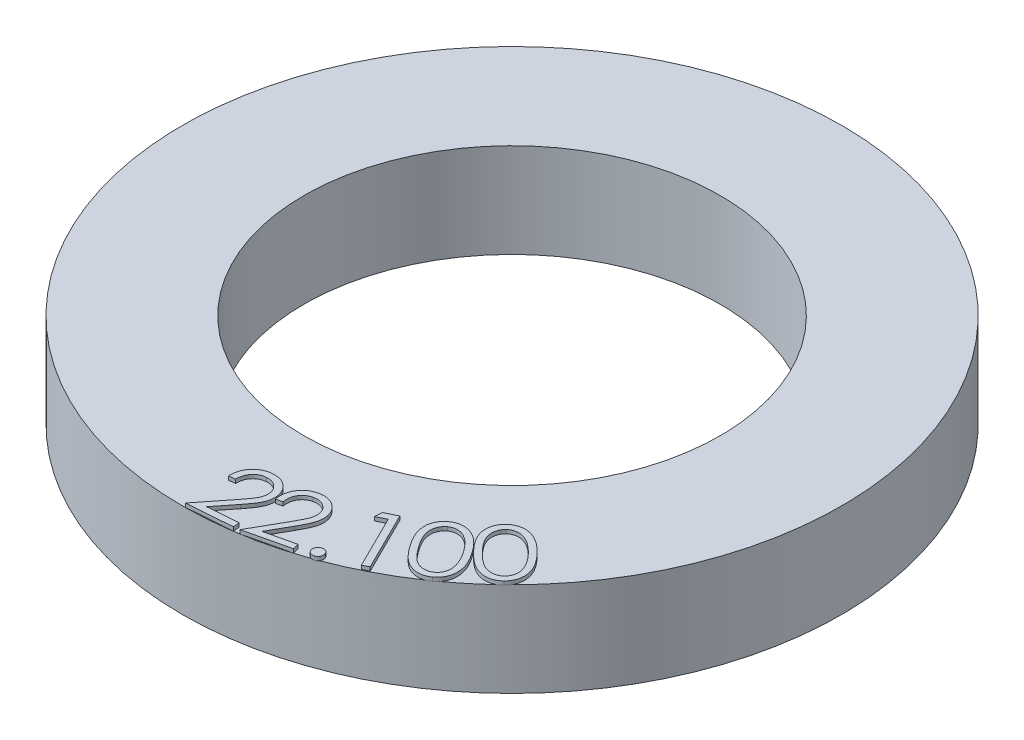
from build123d import *

# Parameters (mm, degrees)
SKETCH1_R           = 17.5
SKETCH1_R_2         = 11.05
BOSS_EXTRUDE1_DEPTH = 5
BOSS_EXTRUDE5_DEPTH = 0.2


with BuildPart() as part:
    # Sketch1 → Boss-Extrude1 (new body)
    with BuildSketch(Plane(origin=(0, 0, 0), x_dir=(1, 0, 0), z_dir=(0, 1, 0))):
        Circle(SKETCH1_R)
        Circle(SKETCH1_R_2, mode=Mode.SUBTRACT)
    extrude(amount=BOSS_EXTRUDE1_DEPTH)

    # Sketch5 → Boss-Extrude5 (add)
    # profile 1 of 6: a face of its own
    with BuildSketch(Plane(origin=(0, 5, 0), x_dir=(1, 0, 0), z_dir=(0, 1, 0))):
        with BuildLine():
            Line((0.377203526, -15.06640625), (0.043469551, -15.092347756))
            add(Edge.make_bspline(
                [(0.043469551, -15.092347756), (0.042203297, -15.050032699), (0.039723419, -14.96716131), (0.049638285, -14.844981972), (0.067688405, -14.727624407), (0.098455755, -14.61556583), (0.138504263, -14.508522308), (0.188279293, -14.405930448), (0.249943807, -14.309195828), (0.320224245, -14.217586795), (0.399116148, -14.133937543), (0.484222111, -14.059456033), (0.574336923, -13.993992114), (0.671078969, -13.940092371), (0.773224869, -13.895612995), (0.881084602, -13.861423192), (0.994390789, -13.836174987), (1.072362547, -13.828578994), (1.111979167, -13.824719551)],
                knots=[0, 0, 0, 0, 1.099165856, 2.152647473, 3.179901334, 4.180092559, 5.165857059, 6.14623908, 7.136854445, 8.141313093, 9.142222958, 10.119044223, 11.076246807, 12.030555843, 12.990566437, 13.966122304, 14.966608418, 16, 16, 16, 16], degree=3))
            add(Edge.make_bspline(
                [(1.111979167, -13.824719551), (1.151232363, -13.822614291), (1.227892409, -13.818502795), (1.341072803, -13.824300473), (1.449209712, -13.840047194), (1.552456645, -13.867170925), (1.650809554, -13.903432336), (1.744251767, -13.950064736), (1.832189716, -14.007297288), (1.914237577, -14.07371881), (1.989801801, -14.146775331), (2.056191283, -14.225750107), (2.115236363, -14.307662186), (2.163673815, -14.394967734), (2.203994369, -14.485852699), (2.23381166, -14.581483532), (2.256306856, -14.680631266), (2.263224051, -14.74868976), (2.266726763, -14.783153045)],
                knots=[0, 0, 0, 0, 1.125255338, 2.197582177, 3.23984224, 4.249678898, 5.249348258, 6.237204937, 7.234226399, 8.248247252, 9.256507582, 10.239567543, 11.199778339, 12.143800945, 13.093950023, 14.042329097, 15.008679649, 16, 16, 16, 16], degree=3))
            add(Edge.make_bspline(
                [(2.266726763, -14.783153045), (2.268653871, -14.83201524), (2.272472697, -14.928842275), (2.256591946, -15.073272294), (2.221554197, -15.213909987), (2.177756368, -15.329043673), (2.13210079, -15.422970742), (2.088829613, -15.499650514), (2.039151976, -15.583479859), (1.980752569, -15.67318269), (1.913642882, -15.76882397), (1.840613729, -15.872212721), (1.757921696, -15.980725817), (1.700055339, -16.055042687), (1.670072115, -16.093549679)],
                knots=[0, 0, 0, 0, 1.190284496, 2.358709392, 3.525773572, 4.713480732, 5.352743619, 6.06901355, 6.858115264, 7.726847504, 8.676217017, 9.704931629, 10.810819393, 12, 12, 12, 12], degree=3))
            Line((1.670072115, -16.093549679), (0.875701122, -17.094751603))
            Line((0.875701122, -17.094751603), (2.482672276, -16.971354167))
            Line((2.482672276, -16.971354167), (2.508613782, -17.307191506))
            Line((2.508613782, -17.307191506), (0.14443109, -17.488782051))
            Line((0.14443109, -17.488782051), (1.363681891, -15.949819712))
            add(Edge.make_bspline(
                [(1.363681891, -15.949819712), (1.393527022, -15.912554926), (1.450782044, -15.841066007), (1.530584566, -15.73612355), (1.602999147, -15.639675593), (1.666852925, -15.550639363), (1.722438282, -15.469396851), (1.76961629, -15.395481899), (1.809021619, -15.329602995), (1.849329165, -15.251857602), (1.888211722, -15.159145837), (1.917541309, -15.046099013), (1.933704742, -14.93175562), (1.93042781, -14.855174346), (1.928786058, -14.816806891)],
                knots=[0, 0, 0, 0, 1.323859622, 2.539697786, 3.655679983, 4.668207506, 5.577749991, 6.384956845, 7.099630202, 7.705429782, 8.812646299, 9.878423536, 10.93708365, 12, 12, 12, 12], degree=3))
            add(Edge.make_bspline(
                [(1.928786058, -14.816806891), (1.92620974, -14.792668697), (1.921140936, -14.745177743), (1.905685163, -14.675960851), (1.882668381, -14.610204079), (1.854314913, -14.54686504), (1.818130268, -14.487171166), (1.775716227, -14.430480301), (1.726271651, -14.377301953), (1.671340099, -14.327125852), (1.611934069, -14.281949704), (1.548780398, -14.24375581), (1.483443961, -14.212316408), (1.415907726, -14.186368957), (1.345139571, -14.169292508), (1.271999298, -14.157876025), (1.196114655, -14.153502913), (1.144924611, -14.156323447), (1.118990385, -14.157752404)],
                knots=[0, 0, 0, 0, 1.002985613, 1.973335034, 2.923515741, 3.878986154, 4.836651989, 5.802759845, 6.800988188, 7.833639541, 8.87511098, 9.880838076, 10.878972912, 11.86950441, 12.865345595, 13.881918786, 14.926924211, 16, 16, 16, 16], degree=3))
            add(Edge.make_bspline(
                [(1.118990385, -14.157752404), (1.091811261, -14.160540619), (1.038491161, -14.166010548), (0.960749235, -14.182373159), (0.886899306, -14.205342141), (0.817246391, -14.235736869), (0.751710741, -14.272344942), (0.690146343, -14.315288584), (0.633132276, -14.365692478), (0.580060436, -14.422065975), (0.532383632, -14.484564259), (0.490634628, -14.552362028), (0.455698611, -14.625546395), (0.426899376, -14.703718722), (0.404472482, -14.787020099), (0.388336351, -14.875402791), (0.379467781, -14.969236984), (0.377971809, -15.033435801), (0.377203526, -15.06640625)],
                knots=[0, 0, 0, 0, 1.003856858, 1.969369873, 2.914991585, 3.842326504, 4.757764574, 5.67065914, 6.596081697, 7.550367434, 8.512664105, 9.480773, 10.472199548, 11.488843046, 12.539268398, 13.639696742, 14.787824085, 16, 16, 16, 16], degree=3))
        make_face()
    # profile 2 of 6: a face of its own
    with BuildSketch(Plane(origin=(0, 5, 0), x_dir=(1, 0, 0), z_dir=(0, 1, 0))):
        with BuildLine():
            Line((2.680077799, -14.84254585), (2.355458408, -14.918267004))
            add(Edge.make_bspline(
                [(2.355458408, -14.918267004), (2.347994142, -14.876767046), (2.333387531, -14.795556953), (2.323472579, -14.673990721), (2.324976016, -14.555728299), (2.336513827, -14.440605451), (2.359783356, -14.328975701), (2.394590343, -14.221092867), (2.439601661, -14.116379831), (2.494569659, -14.015576781), (2.559832485, -13.921863348), (2.631188548, -13.834656401), (2.710921768, -13.757361702), (2.797573287, -13.688946733), (2.891342116, -13.629703088), (2.992353062, -13.580084855), (3.099856127, -13.537971321), (3.175300136, -13.518303724), (3.213631485, -13.508311075)],
                knots=[0, 0, 0, 0, 1.100238416, 2.153025381, 3.178012026, 4.183884262, 5.168591255, 6.148695239, 7.138002634, 8.140019377, 9.140121407, 10.114951831, 11.077023251, 12.032670763, 12.99234068, 13.966349905, 14.966749606, 16, 16, 16, 16], degree=3))
            add(Edge.make_bspline(
                [(3.213631485, -13.508311075), (3.251843088, -13.50036415), (3.32664053, -13.484808413), (3.438897548, -13.473770246), (3.547813259, -13.472847982), (3.653615731, -13.482442125), (3.755983303, -13.503477882), (3.854414489, -13.536291351), (3.950096274, -13.578421826), (4.040814221, -13.631584861), (4.126003653, -13.692404589), (4.204208412, -13.758970295), (4.274030899, -13.831494589), (4.335160407, -13.90960072), (4.388361962, -13.993145467), (4.432982751, -14.082231672), (4.470178835, -14.176708828), (4.487307474, -14.242643219), (4.495983248, -14.27603944)],
                knots=[0, 0, 0, 0, 1.121990491, 2.196244399, 3.238232453, 4.250969426, 5.246356061, 6.236987075, 7.230101134, 8.248200839, 9.255501669, 10.237657177, 11.19803806, 12.146105858, 13.086011545, 14.042029985, 15.008274769, 16, 16, 16, 16], degree=3))
            add(Edge.make_bspline(
                [(4.495983248, -14.27603944), (4.505415824, -14.323774993), (4.524110077, -14.41838123), (4.529985585, -14.56283772), (4.516844757, -14.706380405), (4.49162199, -14.826395359), (4.460506924, -14.925374116), (4.431085731, -15.007919873), (4.393488718, -15.097141834), (4.349829317, -15.194418504), (4.299347185, -15.299042154), (4.242538162, -15.411720311), (4.177915647, -15.531101044), (4.131979942, -15.612908193), (4.108262895, -15.655146011)],
                knots=[0, 0, 0, 0, 1.190223456, 2.358882579, 3.52524119, 4.712819824, 5.35365978, 6.065105631, 6.857984567, 7.723828008, 8.67607557, 9.702436758, 10.813745988, 12, 12, 12, 12], degree=3))
            Line((4.108262895, -15.655146011), (3.479356645, -16.761516203))
            Line((3.479356645, -16.761516203), (5.041456004, -16.394829504))
            Line((5.041456004, -16.394829504), (5.11787828, -16.721552261))
            Line((5.11787828, -16.721552261), (2.819601036, -17.260714921))
            Line((2.819601036, -17.260714921), (3.785045748, -15.56119569))
            add(Edge.make_bspline(
                [(3.785045748, -15.56119569), (3.808529371, -15.519892567), (3.8536226, -15.440582352), (3.91665988, -15.325551236), (3.973290102, -15.219474376), (4.021957514, -15.121779814), (4.064311127, -15.032979861), (4.100364837, -14.953571722), (4.128654637, -14.882434307), (4.156784414, -14.800101176), (4.179688984, -14.702577351), (4.192972915, -14.587024863), (4.189968714, -14.471889792), (4.175230987, -14.396958355), (4.167858248, -14.359472934)],
                knots=[0, 0, 0, 0, 1.322508168, 2.539478858, 3.65113322, 4.669382137, 5.577246142, 6.389686428, 7.096378664, 7.707362647, 8.810322298, 9.877140803, 10.938012216, 12, 12, 12, 12], degree=3))
            add(Edge.make_bspline(
                [(4.167858248, -14.359472934), (4.161829404, -14.336171476), (4.149935411, -14.290201239), (4.123387221, -14.224893717), (4.091995869, -14.16328915), (4.053584185, -14.106135055), (4.009399893, -14.052600205), (3.95860095, -14.003544562), (3.901957352, -13.958350343), (3.840235373, -13.917568468), (3.775029978, -13.881814057), (3.707248163, -13.853637752), (3.637912338, -13.832678602), (3.56741324, -13.817301491), (3.494890393, -13.811664684), (3.421495235, -13.811468351), (3.346244991, -13.818247864), (3.296509601, -13.82889709), (3.271123472, -13.834332709)],
                knots=[0, 0, 0, 0, 0.998805992, 1.97049261, 2.921394182, 3.866479787, 4.824835265, 5.799717433, 6.794315519, 7.830951375, 8.869177059, 9.878822869, 10.873799922, 11.875291578, 12.869368348, 13.888722291, 14.922353531, 16, 16, 16, 16], degree=3))
            add(Edge.make_bspline(
                [(3.271123472, -13.834332709), (3.244792519, -13.841064204), (3.193002937, -13.854304184), (3.119061623, -13.882705923), (3.050115946, -13.91714881), (2.986034959, -13.957311139), (2.926579811, -14.002814596), (2.87305675, -14.05555418), (2.823928987, -14.113545846), (2.780414933, -14.177443519), (2.743380272, -14.246402199), (2.712244756, -14.319205359), (2.689061885, -14.396615139), (2.673136557, -14.477873433), (2.664009273, -14.563501926), (2.662180891, -14.653056839), (2.666949138, -14.746824786), (2.675629023, -14.810109822), (2.680077799, -14.84254585)],
                knots=[0, 0, 0, 0, 1.001857296, 1.97052376, 2.915105733, 3.840812044, 4.756468097, 5.670946457, 6.606992161, 7.556283339, 8.516782409, 9.490308786, 10.47212129, 11.491627338, 12.540773751, 13.644567144, 14.792749573, 16, 16, 16, 16], degree=3))
        make_face()
    # profile 3 of 6: a face of its own
    with BuildSketch(Plane(origin=(0, 5, 0), x_dir=(1, 0, 0), z_dir=(0, 1, 0))):
        with BuildLine():
            add(Edge.make_bspline(
                [(5.812610444, -15.938128556), (5.831374417, -15.932374898), (5.868100028, -15.921113607), (5.925587729, -15.918820778), (5.982023209, -15.927326543), (6.036365652, -15.947186897), (6.086750753, -15.976062519), (6.129683552, -16.014781695), (6.164195697, -16.061839206), (6.179302393, -16.097844445), (6.187009483, -16.116213491)],
                knots=[0, 0, 0, 0, 1.018533362, 1.993514881, 2.966138152, 3.9748784, 4.989476654, 5.972026843, 6.965374611, 8, 8, 8, 8], degree=3))
            add(Edge.make_bspline(
                [(6.187009483, -16.116213491), (6.192680674, -16.134982532), (6.203852009, -16.171954526), (6.207259114, -16.229869607), (6.198423544, -16.286997519), (6.178873974, -16.341926891), (6.149719297, -16.392227049), (6.111823907, -16.435344643), (6.065578658, -16.469979456), (6.029886494, -16.484584723), (6.011729034, -16.492014773)],
                knots=[0, 0, 0, 0, 1.018247088, 2.005783202, 2.990165439, 4.010083513, 5.024396598, 5.998572224, 6.981825626, 8, 8, 8, 8], degree=3))
            add(Edge.make_bspline(
                [(6.011729034, -16.492014773), (5.992964701, -16.497770106), (5.956238387, -16.509034678), (5.898755786, -16.511303732), (5.842003107, -16.502843983), (5.787364663, -16.482393394), (5.737095106, -16.452595757), (5.694096527, -16.414271405), (5.660232144, -16.367416245), (5.645083379, -16.332037335), (5.637329996, -16.313929838)],
                knots=[0, 0, 0, 0, 1.019327242, 1.995068695, 2.968450063, 3.99358383, 5.015165017, 5.99848104, 6.975590248, 8, 8, 8, 8], degree=3))
            add(Edge.make_bspline(
                [(5.637329996, -16.313929838), (5.63125142, -16.294941947), (5.619366426, -16.257816312), (5.617673921, -16.1996281), (5.624612676, -16.142442807), (5.645777227, -16.087974496), (5.675371175, -16.038150206), (5.712952105, -15.994657098), (5.759716127, -15.961248414), (5.794765915, -15.945928316), (5.812610444, -15.938128556)],
                knots=[0, 0, 0, 0, 1.033330105, 2.02039479, 3.003248301, 4.016090021, 5.036799157, 6.01117572, 6.98745084, 8, 8, 8, 8], degree=3))
        make_face()
    # profile 4 of 6: a face of its own
    with BuildSketch(Plane(origin=(0, 5, 0), x_dir=(1, 0, 0), z_dir=(0, 1, 0))):
        Polygon((5.818273577, -12.696277718), (6.43245627, -12.391289737), (7.984038802, -15.51759182), (7.673441847, -15.671838615), (6.274002744, -12.851926756), (5.783217488, -13.095216019), align=None)
    # profile 5 of 6: a face of its own
    with BuildSketch(Plane(origin=(0, 5, 0), x_dir=(1, 0, 0), z_dir=(0, 1, 0))):
        with BuildLine():
            add(Edge.make_bspline(
                [(8.094622628, -13.519240223), (8.062802559, -13.473618044), (8.000905639, -13.384873031), (7.915172489, -13.252508419), (7.839826708, -13.124911808), (7.772418464, -13.003590397), (7.715531182, -12.886947474), (7.667790368, -12.775573225), (7.628608309, -12.669765668), (7.599775725, -12.568374636), (7.57829551, -12.470964938), (7.564758618, -12.376238395), (7.555557095, -12.284294604), (7.554709495, -12.194779161), (7.558280296, -12.107556209), (7.56976583, -12.022720596), (7.587145911, -11.940382527), (7.611262051, -11.861045683), (7.640449512, -11.784480464), (7.675936321, -11.711756768), (7.714835306, -11.641852914), (7.759909289, -11.576363682), (7.810818614, -11.515563075), (7.86566587, -11.457507344), (7.925820181, -11.403394691), (7.96954674, -11.3711224), (7.991557724, -11.354877242)],
                knots=[0, 0, 0, 0, 1.642969674, 3.19593159, 4.656913794, 6.01942512, 7.294540572, 8.488352722, 9.597764224, 10.624727227, 11.599650019, 12.541783054, 13.449916964, 14.326759598, 15.183784796, 16.026369362, 16.852301942, 17.666934368, 18.473335003, 19.269954597, 20.055155662, 20.834508302, 21.614105503, 22.395381983, 23.192270741, 24, 24, 24, 24], degree=3))
            add(Edge.make_bspline(
                [(7.991557724, -11.354877242), (8.014728533, -11.339369003), (8.060599513, -11.308667524), (8.132399536, -11.268508388), (8.206244921, -11.234711547), (8.282223955, -11.207274971), (8.360094953, -11.18622085), (8.439854178, -11.171628727), (8.521136268, -11.162312696), (8.604110397, -11.159724321), (8.688578721, -11.162812956), (8.773819287, -11.174536389), (8.859848673, -11.192041023), (8.946298698, -11.216384108), (9.032693031, -11.249590455), (9.120586474, -11.287478045), (9.207995817, -11.334602958), (9.297025092, -11.387017274), (9.386746062, -11.44853229), (9.47668636, -11.520010056), (9.567394573, -11.601350717), (9.659297285, -11.691511762), (9.750755999, -11.792501066), (9.844512668, -11.901837519), (9.938055541, -12.021739437), (9.999130712, -12.106053576), (10.030419903, -12.149248236)],
                knots=[0, 0, 0, 0, 0.81737431, 1.618146333, 2.409359726, 3.196287572, 3.98428899, 4.771962527, 5.571913005, 6.381057778, 7.204158073, 8.047410857, 8.900877879, 9.777286907, 10.677253619, 11.613163999, 12.581895576, 13.586798653, 14.641794363, 15.768831792, 16.953190825, 18.213177769, 19.542243662, 20.947154321, 22.436008085, 24, 24, 24, 24], degree=3))
            add(Edge.make_bspline(
                [(10.030419903, -12.149248236), (10.060629559, -12.192752207), (10.119610721, -12.277689116), (10.200846542, -12.405103815), (10.273255924, -12.528865303), (10.337509449, -12.648219026), (10.391181621, -12.764540131), (10.43820567, -12.875909357), (10.475554519, -12.983869211), (10.50344957, -13.088309499), (10.524903819, -13.188904255), (10.538885623, -13.286836764), (10.546725682, -13.381904246), (10.548159793, -13.474420371), (10.543613126, -13.564233062), (10.531370439, -13.651605278), (10.513443822, -13.736309086), (10.488669914, -13.817775923), (10.458612044, -13.895915034), (10.422515108, -13.970199551), (10.382414939, -14.041346734), (10.335121159, -14.10739704), (10.284634864, -14.170670648), (10.227738255, -14.228915781), (10.166760539, -14.284258646), (10.122326211, -14.317244424), (10.099830961, -14.333943749)],
                knots=[0, 0, 0, 0, 1.554546396, 3.035087675, 4.433995603, 5.762808296, 7.011883954, 8.192851325, 9.310096466, 10.361795966, 11.364123238, 12.327475774, 13.263475298, 14.162233118, 15.041618427, 15.900208728, 16.749208619, 17.580395342, 18.396988438, 19.203929376, 20.002899753, 20.790808823, 21.585763951, 22.37656444, 23.178122201, 24, 24, 24, 24], degree=3))
            add(Edge.make_bspline(
                [(10.099830961, -14.333943749), (10.077145847, -14.349248799), (10.032078172, -14.379654774), (9.961226292, -14.41874203), (9.888830277, -14.451849879), (9.814590203, -14.47895069), (9.738195859, -14.498824708), (9.660247994, -14.513948211), (9.580492187, -14.52198494), (9.499406039, -14.52527875), (9.417145054, -14.520571171), (9.334005043, -14.510527935), (9.250744084, -14.491700989), (9.166953442, -14.467370492), (9.082999509, -14.435274057), (8.998560513, -14.396718689), (8.913206968, -14.351906005), (8.827985738, -14.298567689), (8.7409939, -14.237532695), (8.653670568, -14.165241162), (8.563416086, -14.08401014), (8.472884445, -13.99107976), (8.379836956, -13.888342291), (8.285786421, -13.774791097), (8.189344545, -13.65134699), (8.126795343, -13.564110867), (8.094622628, -13.519240223)],
                knots=[0, 0, 0, 0, 0.809272868, 1.607752371, 2.390541581, 3.162600615, 3.942452978, 4.723530369, 5.509215026, 6.311725545, 7.121736464, 7.944163862, 8.786349334, 9.643974587, 10.523613564, 11.442588803, 12.389010581, 13.373290706, 14.414956715, 15.530440954, 16.724797808, 18.00575213, 19.366615439, 20.824635093, 22.366724005, 24, 24, 24, 24], degree=3))
        make_face()
        with BuildLine():
            add(Edge.make_bspline(
                [(8.365956762, -13.335546313), (8.393510609, -13.374297237), (8.446854462, -13.449318471), (8.528670384, -13.555366739), (8.60742359, -13.652413873), (8.683255254, -13.740695546), (8.756871397, -13.819358639), (8.828009376, -13.888883065), (8.897135344, -13.948671365), (8.983061364, -14.016109508), (9.090682186, -14.083183592), (9.220880812, -14.144186183), (9.351696053, -14.182240709), (9.481053903, -14.197814082), (9.605574298, -14.192509381), (9.722863886, -14.171389658), (9.831778948, -14.131421788), (9.89596962, -14.090684827), (9.928056121, -14.070321954)],
                knots=[0, 0, 0, 0, 1.1827903, 2.289865089, 3.331380946, 4.291831117, 5.184420272, 6.010858608, 6.765099688, 7.457072956, 8.726634343, 9.910338833, 11.023625153, 12.101035577, 13.136741818, 14.112849547, 15.056684504, 16, 16, 16, 16], degree=3))
            add(Edge.make_bspline(
                [(9.928056121, -14.070321954), (9.958199072, -14.04678767), (10.018343826, -13.999829305), (10.092226445, -13.911003214), (10.151977219, -13.809676547), (10.188798626, -13.71588697), (10.21025699, -13.63528289), (10.221226632, -13.571686685), (10.227787531, -13.505846005), (10.228373195, -13.438049047), (10.223135367, -13.368026291), (10.213304743, -13.296150287), (10.19866591, -13.22182417), (10.184779219, -13.17233303), (10.17765548, -13.14694455)],
                knots=[0, 0, 0, 0, 1.341040386, 2.675801171, 4.031107013, 5.461979847, 6.201214193, 6.960221384, 7.727760243, 8.524631316, 9.339919908, 10.193817199, 11.073445551, 12, 12, 12, 12], degree=3))
            add(Edge.make_bspline(
                [(10.17765548, -13.14694455), (10.167938882, -13.115049884), (10.148263929, -13.050466983), (10.111960299, -12.953900562), (10.069762738, -12.855689717), (10.021636612, -12.755637251), (9.966504562, -12.654693832), (9.906049555, -12.551974848), (9.839582479, -12.447706175), (9.791796167, -12.37859734), (9.76749923, -12.343458973)],
                knots=[0, 0, 0, 0, 0.882770903, 1.78750597, 2.7301835, 3.712848721, 4.726406589, 5.775105665, 6.868753104, 8, 8, 8, 8], degree=3))
            add(Edge.make_bspline(
                [(9.76749923, -12.343458973), (9.742469511, -12.308714131), (9.693584027, -12.240854065), (9.618463937, -12.144094543), (9.544192078, -12.054230221), (9.470562895, -11.971190569), (9.397045064, -11.895188191), (9.32314986, -11.826925813), (9.251403872, -11.763699841), (9.178695529, -11.709212967), (9.107364869, -11.660697413), (9.036821099, -11.61850894), (8.967728429, -11.581484804), (8.89867186, -11.552421598), (8.831225963, -11.527997279), (8.764360431, -11.510428798), (8.698428352, -11.498992319), (8.613566434, -11.493001321), (8.511380475, -11.495703996), (8.395399698, -11.518634592), (8.287095086, -11.557097897), (8.223682656, -11.597608066), (8.192078557, -11.617797915)],
                knots=[0, 0, 0, 0, 1.331638351, 2.600819572, 3.808731856, 4.956753649, 6.0515447, 7.095453716, 8.084829487, 9.023883899, 9.918928688, 10.766532722, 11.5792985, 12.354234065, 13.094443839, 13.808425764, 14.501457742, 15.172059793, 16.451996366, 17.66645092, 18.8369833, 20, 20, 20, 20], degree=3))
            add(Edge.make_bspline(
                [(8.192078557, -11.617797915), (8.162180822, -11.641349129), (8.102244695, -11.688562358), (8.028366359, -11.777948466), (7.968925161, -11.880744507), (7.931685436, -11.975580094), (7.909095681, -12.056724502), (7.898140233, -12.120876356), (7.891858749, -12.186959221), (7.890310606, -12.255177544), (7.894814366, -12.3252212), (7.904067545, -12.397326462), (7.91815239, -12.471290358), (7.937014839, -12.548086786), (7.96374743, -12.62826749), (7.997367428, -12.713487472), (8.038833915, -12.804161775), (8.089333614, -12.899597728), (8.146737354, -13.001133645), (8.211859923, -13.108450678), (8.285815521, -13.220565596), (8.338673709, -13.296402609), (8.365956762, -13.335546313)],
                knots=[0, 0, 0, 0, 1.180606091, 2.366766537, 3.578074944, 4.859878886, 5.522639199, 6.193986847, 6.88011338, 7.585064265, 8.312970028, 9.060096195, 9.843880725, 10.652758785, 11.516709204, 12.469302462, 13.499998018, 14.614729803, 15.825100775, 17.126058077, 18.516598594, 20, 20, 20, 20], degree=3))
        make_face(mode=Mode.SUBTRACT)
    # profile 6 of 6: a face of its own
    with BuildSketch(Plane(origin=(0, 5, 0), x_dir=(1, 0, 0), z_dir=(0, 1, 0))):
        with BuildLine():
            add(Edge.make_bspline(
                [(10.061528562, -12.10955222), (10.022956902, -12.068877282), (9.948043998, -11.989879446), (9.843004253, -11.871191764), (9.746856726, -11.757152028), (9.662558794, -11.645801129), (9.587265593, -11.538869256), (9.523014434, -11.435213056), (9.467760847, -11.335853691), (9.423120937, -11.239404772), (9.387161115, -11.145589547), (9.358439609, -11.053481538), (9.335685504, -10.96320001), (9.320265408, -10.874124207), (9.310912512, -10.786766665), (9.308712669, -10.700467974), (9.313761542, -10.61585785), (9.324855221, -10.532846238), (9.342571358, -10.452301381), (9.365447521, -10.37404815), (9.395206402, -10.299293261), (9.429624987, -10.226848525), (9.470387016, -10.157948288), (9.51591285, -10.091366706), (9.568349735, -10.028763459), (9.606703214, -9.989578446), (9.626131928, -9.969728502)],
                knots=[0, 0, 0, 0, 1.643143098, 3.191270976, 4.645664262, 6.014553529, 7.284140096, 8.478046464, 9.588014013, 10.61488382, 11.590779053, 12.531207317, 13.441789177, 14.318091217, 15.179101305, 16.015191765, 16.845564482, 17.661395641, 18.467677819, 19.261049258, 20.048571613, 20.823839802, 21.609930406, 22.392909899, 23.185896688, 24, 24, 24, 24], degree=3))
            add(Edge.make_bspline(
                [(9.626131928, -9.969728502), (9.646645091, -9.95069727), (9.687318886, -9.912961868), (9.752951978, -9.86262558), (9.82097751, -9.817156486), (9.892700351, -9.779015734), (9.966623737, -9.745702257), (10.043514762, -9.718255129), (10.123183777, -9.696568041), (10.20571016, -9.68103803), (10.290338148, -9.672191802), (10.376851129, -9.668875627), (10.464943764, -9.674490451), (10.554730722, -9.68541183), (10.646285721, -9.703999117), (10.739509478, -9.729242319), (10.834274843, -9.761744286), (10.930937146, -9.801087051), (11.029460742, -9.849217028), (11.13026139, -9.90588491), (11.233052994, -9.972445027), (11.338150651, -10.048209415), (11.4454711, -10.133940855), (11.554567784, -10.229792228), (11.66690382, -10.33373637), (11.740312315, -10.408325038), (11.777874716, -10.446491322)],
                knots=[0, 0, 0, 0, 0.814307392, 1.614620432, 2.405388273, 3.193927934, 3.97672154, 4.764468093, 5.568360162, 6.378448907, 7.206542137, 8.043948668, 8.895854568, 9.773619782, 10.675734413, 11.613311544, 12.583794371, 13.590896081, 14.649966002, 15.774206342, 16.955777189, 18.213503254, 19.545065278, 20.953335129, 22.441051684, 24, 24, 24, 24], degree=3))
            add(Edge.make_bspline(
                [(11.777874716, -10.446491322), (11.814854184, -10.485255248), (11.887044241, -10.560928863), (11.987574534, -10.675759496), (12.079295527, -10.787542626), (12.161694512, -10.896673681), (12.23353433, -11.004058588), (12.297534335, -11.10782118), (12.35070381, -11.20969791), (12.395436672, -11.308899574), (12.430866619, -11.406229864), (12.460879856, -11.501034296), (12.483379386, -11.594506766), (12.498899769, -11.686339274), (12.507460043, -11.776558786), (12.508968567, -11.865183233), (12.503213493, -11.952124966), (12.491394927, -12.037228558), (12.473097417, -12.119669422), (12.449411404, -12.199534266), (12.418928204, -12.275666565), (12.384035539, -12.349408099), (12.342167974, -12.419239764), (12.296135004, -12.487072917), (12.243421183, -12.551026654), (12.204245084, -12.590356211), (12.184525357, -12.610153181)],
                knots=[0, 0, 0, 0, 1.560920867, 3.047176545, 4.445805626, 5.773746473, 7.029772118, 8.209369219, 9.324227381, 10.375918751, 11.377815375, 12.340623291, 13.272194005, 14.176790602, 15.052286813, 15.910448986, 16.756638747, 17.588735874, 18.411585632, 19.215188949, 20.013145761, 20.798980117, 21.589668162, 22.383020387, 23.186075276, 24, 24, 24, 24], degree=3))
            add(Edge.make_bspline(
                [(12.184525357, -12.610153181), (12.16424862, -12.628954402), (12.124046156, -12.666231375), (12.059224592, -12.715701109), (11.992305933, -12.76050639), (11.922365456, -12.798903796), (11.849611869, -12.831325824), (11.774360209, -12.858062908), (11.696280994, -12.878994313), (11.615756722, -12.894783135), (11.532904199, -12.902798821), (11.448531042, -12.905134253), (11.36269871, -12.900118518), (11.275611133, -12.887862414), (11.186983445, -12.869740367), (11.096865638, -12.844171226), (11.005431965, -12.811821524), (10.911644662, -12.773094239), (10.81603972, -12.725093808), (10.717752152, -12.667036278), (10.615902013, -12.59978748), (10.511364422, -12.521162265), (10.402950549, -12.433133181), (10.291585958, -12.334444112), (10.176237024, -12.226733802), (10.100490943, -12.149354631), (10.061528562, -12.10955222)],
                knots=[0, 0, 0, 0, 0.811064481, 1.60808856, 2.389888403, 3.172620267, 3.946285432, 4.725040954, 5.513640096, 6.316661342, 7.130129069, 7.953396753, 8.791500303, 9.649899588, 10.53226685, 11.444204777, 12.396439187, 13.377193406, 14.420034322, 15.532790691, 16.725465982, 17.999767269, 19.369752981, 20.822718841, 22.365665447, 24, 24, 24, 24], degree=3))
        make_face()
        with BuildLine():
            add(Edge.make_bspline(
                [(10.304116703, -11.884492124), (10.337578269, -11.918574154), (10.402540546, -11.984741), (10.500104054, -12.077699958), (10.593067011, -12.162957402), (10.682719911, -12.238661617), (10.768464434, -12.305349323), (10.849584809, -12.364159763), (10.927584923, -12.413096761), (11.001701443, -12.454772772), (11.07418007, -12.487466292), (11.144334876, -12.516073575), (11.213934525, -12.538566035), (11.282589858, -12.555420101), (11.350311854, -12.566903194), (11.41715019, -12.572295009), (11.483263045, -12.573321261), (11.568750426, -12.566641613), (11.670517579, -12.54720082), (11.783580906, -12.506905605), (11.886149609, -12.450915311), (11.943927533, -12.400472609), (11.972786575, -12.37527738)],
                knots=[0, 0, 0, 0, 1.473957898, 2.861541556, 4.158429599, 5.366384119, 6.48165494, 7.510449078, 8.456966946, 9.322163817, 10.132208232, 10.909042953, 11.659478826, 12.387214262, 13.089187375, 13.776821919, 14.454856839, 15.127538109, 16.420448759, 17.638738311, 18.820591935, 20, 20, 20, 20], degree=3))
            add(Edge.make_bspline(
                [(11.972786575, -12.37527738), (11.999096913, -12.347144569), (12.051476146, -12.291137113), (12.111356623, -12.191364249), (12.15518686, -12.081272391), (12.177418612, -11.982136745), (12.186980934, -11.898714603), (12.188238906, -11.833712734), (12.183968496, -11.767351683), (12.174006317, -11.699854924), (12.158528791, -11.630950783), (12.137058338, -11.560904501), (12.111550388, -11.488878351), (12.089791002, -11.44169194), (12.078655966, -11.417545008)],
                knots=[0, 0, 0, 0, 1.340944698, 2.669583919, 4.030928969, 5.461188359, 6.19962706, 6.958188698, 7.726289627, 8.517420774, 9.336470106, 10.187844869, 11.072657056, 12, 12, 12, 12], degree=3))
            add(Edge.make_bspline(
                [(12.078655966, -11.417545008), (12.063987821, -11.387250039), (12.034271656, -11.325875523), (11.983464173, -11.23492443), (11.925602706, -11.144183163), (11.862651218, -11.051783909), (11.792167981, -10.959745433), (11.716675467, -10.866265116), (11.634371449, -10.772887308), (11.576158741, -10.711789779), (11.546504524, -10.680666002)],
                knots=[0, 0, 0, 0, 0.884558049, 1.79202434, 2.736150632, 3.71244019, 4.72966929, 5.78206634, 6.87015931, 8, 8, 8, 8], degree=3))
            add(Edge.make_bspline(
                [(11.546504524, -10.680666002), (11.516301384, -10.650102624), (11.457161501, -10.590257369), (11.367546578, -10.505677176), (11.279867397, -10.427540032), (11.193607132, -10.35629109), (11.10797441, -10.292846712), (11.024755152, -10.235143983), (10.943159202, -10.184037211), (10.862523381, -10.140895389), (10.783992203, -10.103457249), (10.707158132, -10.072406083), (10.632416474, -10.047329921), (10.559769283, -10.027135588), (10.488709433, -10.013658365), (10.419504972, -10.006866602), (10.352163725, -10.004956096), (10.266745298, -10.012015905), (10.165243051, -10.030256677), (10.053220513, -10.071098865), (9.951222655, -10.125903849), (9.89428322, -10.176093731), (9.865915582, -10.201098694)],
                knots=[0, 0, 0, 0, 1.326591129, 2.597559181, 3.803812624, 4.952220953, 6.050454968, 7.093242857, 8.07839134, 9.021111463, 9.915189371, 10.763364664, 11.577972641, 12.348162485, 13.089731918, 13.807721709, 14.493365527, 15.166324271, 16.451327591, 17.663329693, 18.835853919, 20, 20, 20, 20], degree=3))
            add(Edge.make_bspline(
                [(9.865915582, -10.201098694), (9.839602185, -10.229223864), (9.787080212, -10.285362167), (9.727011752, -10.385763893), (9.684471656, -10.497426589), (9.661850945, -10.597731936), (9.65250305, -10.682110796), (9.65111291, -10.747808025), (9.655590871, -10.814344744), (9.664646974, -10.88234401), (9.679586891, -10.951369214), (9.699237993, -11.021928223), (9.724553286, -11.09336078), (9.755832937, -11.166465722), (9.794229351, -11.242469839), (9.841254557, -11.321957006), (9.897038472, -11.40550307), (9.961236995, -11.493358688), (10.033850008, -11.585802517), (10.116607022, -11.681586658), (10.206493435, -11.782641277), (10.270939053, -11.849877715), (10.304116703, -11.884492124)],
                knots=[0, 0, 0, 0, 1.185970551, 2.367216757, 3.582004018, 4.861034475, 5.528469342, 6.19936335, 6.885891938, 7.584587042, 8.314486342, 9.063449579, 9.843573315, 10.65137712, 11.515794273, 12.469475821, 13.499641158, 14.614767356, 15.826768159, 17.126133982, 18.52048713, 20, 20, 20, 20], degree=3))
        make_face(mode=Mode.SUBTRACT)
    extrude(amount=BOSS_EXTRUDE5_DEPTH)


solid = part.part
